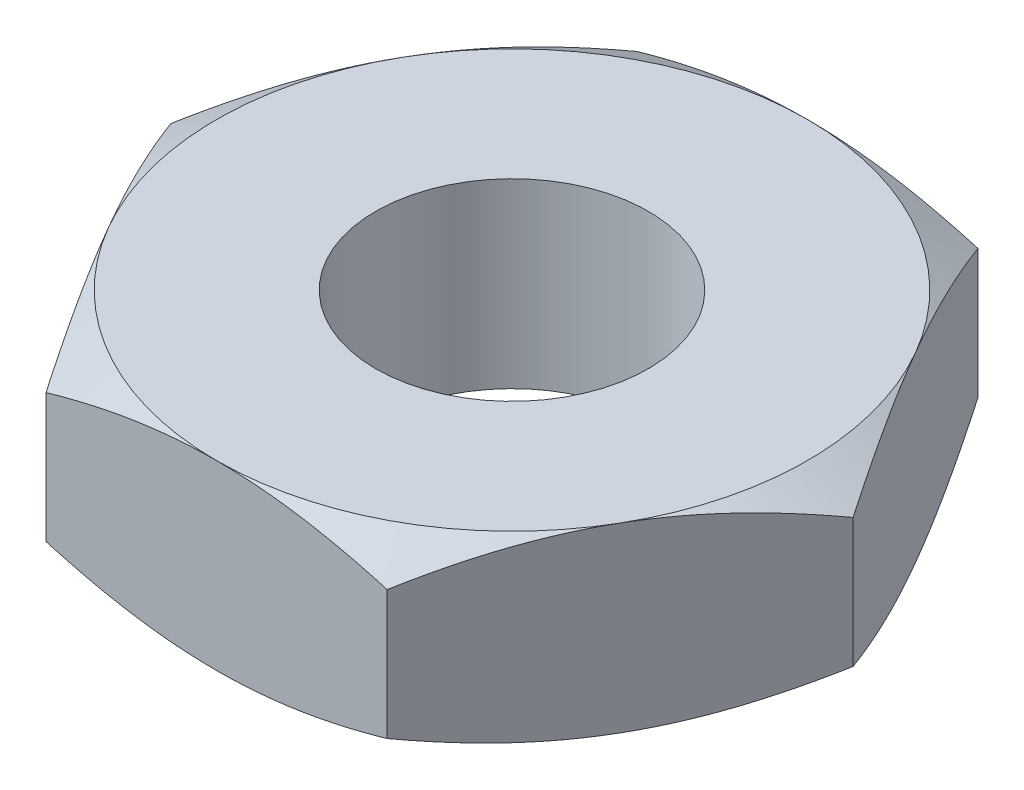
from build123d import *

# Parameters (mm, degrees)
BOSS_EXTRUDE1_DEPTH     = 8
SKETCH2_R               = 6
CUT_EXTRUDE1_DEPTH      = 22.408720964
SKETCH3_OUTSIDE_W       = 67.838
SKETCH3_OUTSIDE_H       = 63.816
SKETCH3_OUTSIDE_R       = 13
CUT_EXTRUDE2_DEPTH      = 8
CUT_EXTRUDE2_DRAFT      = -60
MIRROR1_COPY_1_SKETCH_W = 67.838
MIRROR1_COPY_1_SKETCH_H = 63.816
MIRROR1_COPY_1_SKETCH_R = 13
MIRROR1_COPY_1_DEPTH    = 8
MIRROR1_COPY_1_DRAFT    = -60


with BuildPart() as part:
    # Sketch1 → Boss-Extrude1 (new body)
    with BuildSketch(Plane(origin=(0, 0, 0), x_dir=(1, 0, 0), z_dir=(0, 1, 0))):
        Polygon((7.505553499, -13), (15.011106999, 0), (7.505553499, 13), (-7.505553499, 13), (-15.011106999, 0), (-7.505553499, -13), align=None)
    extrude(amount=BOSS_EXTRUDE1_DEPTH)

    # Sketch2 → Cut-Extrude1 (cut, through all)
    with BuildSketch(Plane(origin=(0, 8, 0), x_dir=(1, 0, 0), z_dir=(0, 1, 0))):
        with Locations(Location((0, 0, 0), (0, 0, 270))):
            Circle(SKETCH2_R)
    extrude(amount=-CUT_EXTRUDE1_DEPTH, mode=Mode.SUBTRACT)


with BuildPart() as cut_extrude2_tool:
    # Sketch3 outside → Cut-Extrude2 (with draft: the straight prism first)
    with BuildSketch(Plane(origin=(0, 8, 0), x_dir=(1, 0, 0), z_dir=(0, 1, 0))):
        Rectangle(SKETCH3_OUTSIDE_W, SKETCH3_OUTSIDE_H)
        Circle(SKETCH3_OUTSIDE_R, mode=Mode.SUBTRACT)
    extrude(amount=-CUT_EXTRUDE2_DEPTH)
    # Cut-Extrude2: the draft: its side faces are tilted about the plane it starts from
    cut_extrude2_sides = [cut_extrude2_tool.faces().sort_by_distance(p)[0] for p in [
        (0, 4, 31.908),
        (33.919, 4, 0),
        (0, 4, -31.908),
        (-33.919, 4, 0),
        (-13, 4, 0),
    ]]
    draft(cut_extrude2_sides, Plane(origin=(0, 8, 0), x_dir=(1, 0, 0), z_dir=(0, 1, 0)), CUT_EXTRUDE2_DRAFT)


with BuildPart() as part_1:
    add(part.part)

    # Cut-Extrude2: cut by cut_extrude2_tool
    add(cut_extrude2_tool.part, mode=Mode.SUBTRACT)


with BuildPart() as mirror1_copy_1_tool:
    # Mirror1 copy 1 sketch → Mirror1 copy 1 (with draft: the straight prism first)
    with BuildSketch(Plane.XZ):
        Rectangle(MIRROR1_COPY_1_SKETCH_W, MIRROR1_COPY_1_SKETCH_H)
        Circle(MIRROR1_COPY_1_SKETCH_R, mode=Mode.SUBTRACT)
    extrude(amount=-MIRROR1_COPY_1_DEPTH)
    # Mirror1 copy 1: the draft: its side faces are tilted about the plane it starts from
    mirror1_copy_1_sides = [mirror1_copy_1_tool.faces().sort_by_distance(p)[0] for p in [
        (0, 4, 31.908),
        (33.919, 4, 0),
        (0, 4, -31.908),
        (-33.919, 4, 0),
        (-13, 4, 0),
    ]]
    draft(mirror1_copy_1_sides, Plane.XZ, MIRROR1_COPY_1_DRAFT)


with BuildPart() as part_2:
    add(part_1.part)

    # Mirror1 copy 1: cut by mirror1_copy_1_tool
    add(mirror1_copy_1_tool.part, mode=Mode.SUBTRACT)


solid = part_2.part
